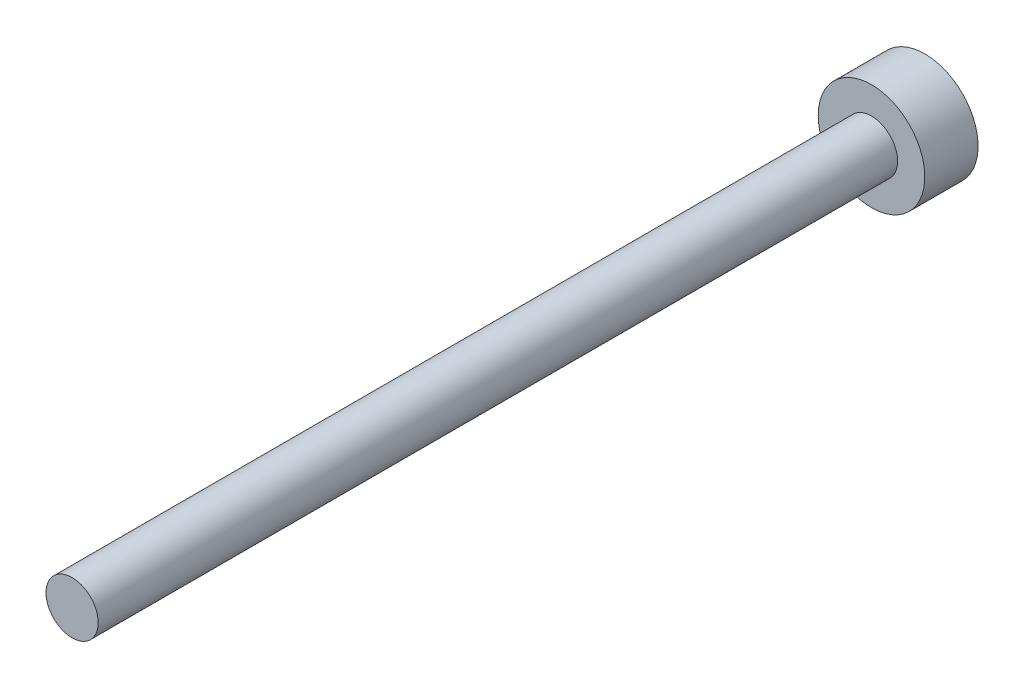
from build123d import *

# Parameters (mm, degrees)
SKETCH_1_R      = 2.45
EXTRUDE_1_DEPTH = 80
SKETCH_2_R      = 5
EXTRUDE_2_DEPTH = 5


with BuildPart() as part:
    # 草图1 → 凸台-拉伸1 (new body)
    with BuildSketch(Plane.XY):
        Circle(SKETCH_1_R)
    extrude(amount=EXTRUDE_1_DEPTH)

    # 草图2 → 凸台-拉伸2 (add)
    with BuildSketch(Plane(origin=(0, 0, 0), x_dir=(-1, 0, 0), z_dir=(0, 0, -1))):
        Circle(SKETCH_2_R)
    extrude(amount=-EXTRUDE_2_DEPTH)


solid = part.part
